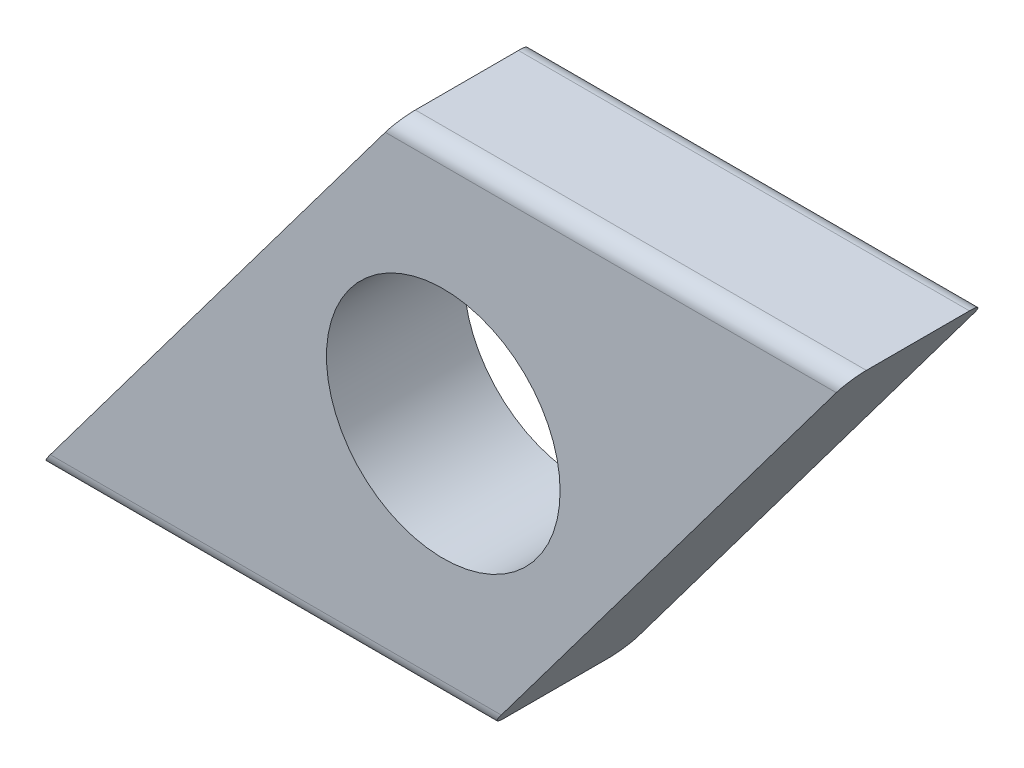
from build123d import *

# Parameters (mm, degrees)
EXTRUDE_1_DEPTH        = 4
HOLE_WIZARD_M8_1_D     = 6.8
HOLE_WIZARD_M8_1_DEPTH = 19.75
HOLE_WIZARD_M8_1_TIP   = 2.042926105
FILLET_1_R             = 0.5


with BuildPart() as part:
    # 草图1 → 凸台-拉伸1 (new body)
    with BuildSketch(Plane.XY):
        Polygon((10.5, 14), (0, 0), (13.125, 0), (23.625, 14), align=None)
    extrude(amount=EXTRUDE_1_DEPTH)

    # M8 螺纹孔1
    with Locations(Plane(origin=(11.8125, 7, 4), x_dir=(1, 0, 0), z_dir=(0, 0, 1))):
        with Locations((0, 0)):
            Hole(HOLE_WIZARD_M8_1_D / 2, depth=HOLE_WIZARD_M8_1_DEPTH)
            with Locations((0, 0, -(HOLE_WIZARD_M8_1_DEPTH + HOLE_WIZARD_M8_1_TIP / 2))):  # 118° drill point
                Cone(0, HOLE_WIZARD_M8_1_D / 2, HOLE_WIZARD_M8_1_TIP, mode=Mode.SUBTRACT)

    # 圆角1
    fillet_1_edges = [part.edges().sort_by_distance(p)[0] for p in [
        (6.5625, 0, 4),
        (17.0625, 14, 4),
        (6.5625, 0, 0),
        (17.0625, 14, 0),
    ]]
    fillet(fillet_1_edges, radius=FILLET_1_R)


solid = part.part
